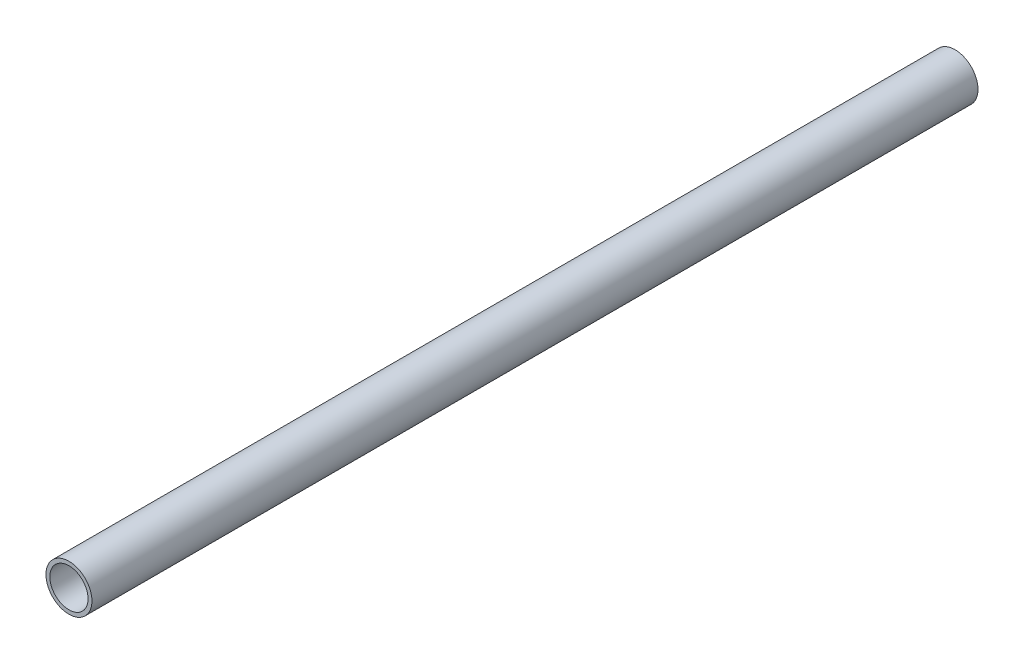
from build123d import *

# Parameters (mm, degrees)
SKETCH1_R           = 21.082
SKETCH1_R_2         = 17.526
BOSS_EXTRUDE1_DEPTH = 812.8


with BuildPart() as part:
    # Sketch1 → Boss-Extrude1 (new body)
    with BuildSketch(Plane.XY):
        Circle(SKETCH1_R)
        Circle(SKETCH1_R_2, mode=Mode.SUBTRACT)
    extrude(amount=-BOSS_EXTRUDE1_DEPTH)


solid = part.part
